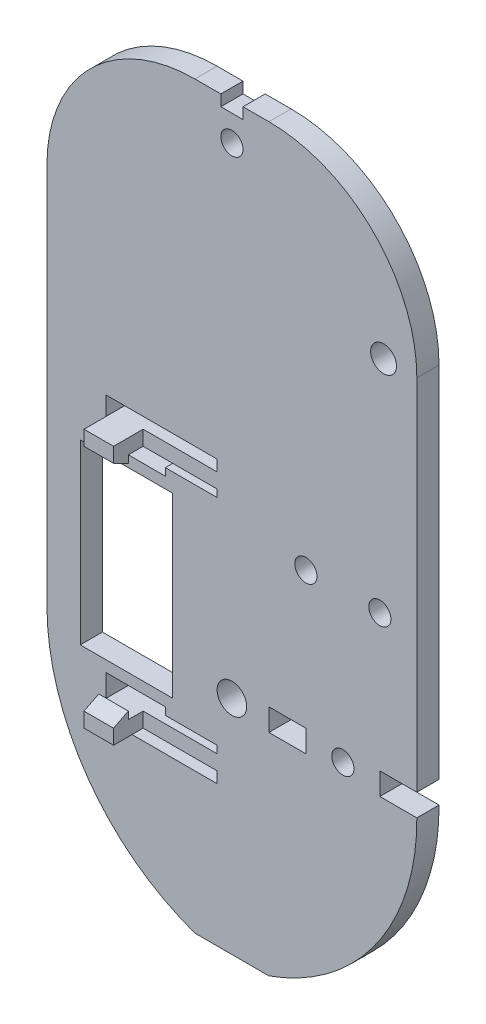
from build123d import *

# Parameters (mm, degrees)
ESQUISSE1_W        = 12.5
ESQUISSE1_H        = 24
ESQUISSE1_R        = 2
ESQUISSE1_W_2      = 5
ESQUISSE1_H_2      = 3
ESQUISSE1_R_2      = 1.5
ESQUISSE1_R_3      = 1.75
BOSS_EXTRU_1_DEPTH = 3
BOSS_EXTRU_2_DEPTH = 4


with BuildPart() as part:
    # Esquisse1 → Boss.-Extru.1 (new body)
    with BuildSketch(Plane.XY):
        with BuildLine():
            Line((-30, 0), (-20, 0))
            ThreePointArc((-20, 0), (-5.505102572, 10.963763172), (0, 28.284271247))
            ThreePointArc((0, 28.284271247), (-0.000193915, 28.392136321), (-0.000775658, 28.5))
            Line((-0.000775658, 28.5), (-5, 28.5))
            Line((-5, 28.5), (-5, 31.5))
            Line((-5, 31.5), (0, 31.5))
            Line((0, 31.5), (0, 80))
            ThreePointArc((0, 80), (-5.857864376, 94.142135624), (-20, 100))
            Line((-20, 100), (-23.5, 100))
            Line((-23.5, 100), (-23.5, 98.5))
            Line((-23.5, 98.5), (-26.5, 98.5))
            Line((-26.5, 98.5), (-26.5, 100))
            Line((-26.5, 100), (-30, 100))
            ThreePointArc((-30, 100), (-44.142135624, 94.142135624), (-50, 80))
            Line((-50, 80), (-50, 28.284271247))
            ThreePointArc((-50, 28.284271247), (-44.494897428, 10.963763172), (-30, 0))
        make_face()
        Polygon((-42, 19), (-42, 24.5), (-34, 24.5), (-34, 23.5), (-27, 23.5), (-27, 22.5), (-41, 22.5), (-41, 20.5), (-27, 20.5), (-27, 19), (-35, 19), align=None, mode=Mode.SUBTRACT)
        with Locations((-39.25, 38)):
            Rectangle(ESQUISSE1_W, ESQUISSE1_H, mode=Mode.SUBTRACT)
        with Locations((-25, 30)):
            Circle(ESQUISSE1_R, mode=Mode.SUBTRACT)
        with Locations((-17.5, 30)):
            Rectangle(ESQUISSE1_W_2, ESQUISSE1_H_2, mode=Mode.SUBTRACT)
        with Locations((-10, 30)):
            Circle(ESQUISSE1_R_2, mode=Mode.SUBTRACT)
        Polygon((-34, 52.5), (-34, 51.5), (-42, 51.5), (-42, 57), (-35, 57), (-27, 57), (-27, 55.5), (-41, 55.5), (-41, 53.5), (-27, 53.5), (-27, 52.5), align=None, mode=Mode.SUBTRACT)
        with Locations((-15, 50)):
            Circle(ESQUISSE1_R_2, mode=Mode.SUBTRACT)
        with Locations((-5, 50)):
            Circle(ESQUISSE1_R_2, mode=Mode.SUBTRACT)
        with Locations((-25, 95)):
            Circle(ESQUISSE1_R_2, mode=Mode.SUBTRACT)
        with Locations((-4.5, 80)):
            Circle(ESQUISSE1_R_3, mode=Mode.SUBTRACT)
    extrude(amount=BOSS_EXTRU_1_DEPTH)

    # Esquisse2 → Boss.-Extru.2 (add)
    with BuildSketch(Plane.ZY.offset(41)):
        Polygon((3, 22.5), (5, 22.5), (5, 23.5), (7, 22.5), (7, 20.5), (3, 20.5), (0, 20.5), (0, 22.5), align=None)
    boss_extru_2 = extrude(amount=-BOSS_EXTRU_2_DEPTH)

    # Symétrie1: Boss.-Extru.2 across plane
    add(boss_extru_2.mirror(Plane.ZX.offset(38)))


solid = part.part
